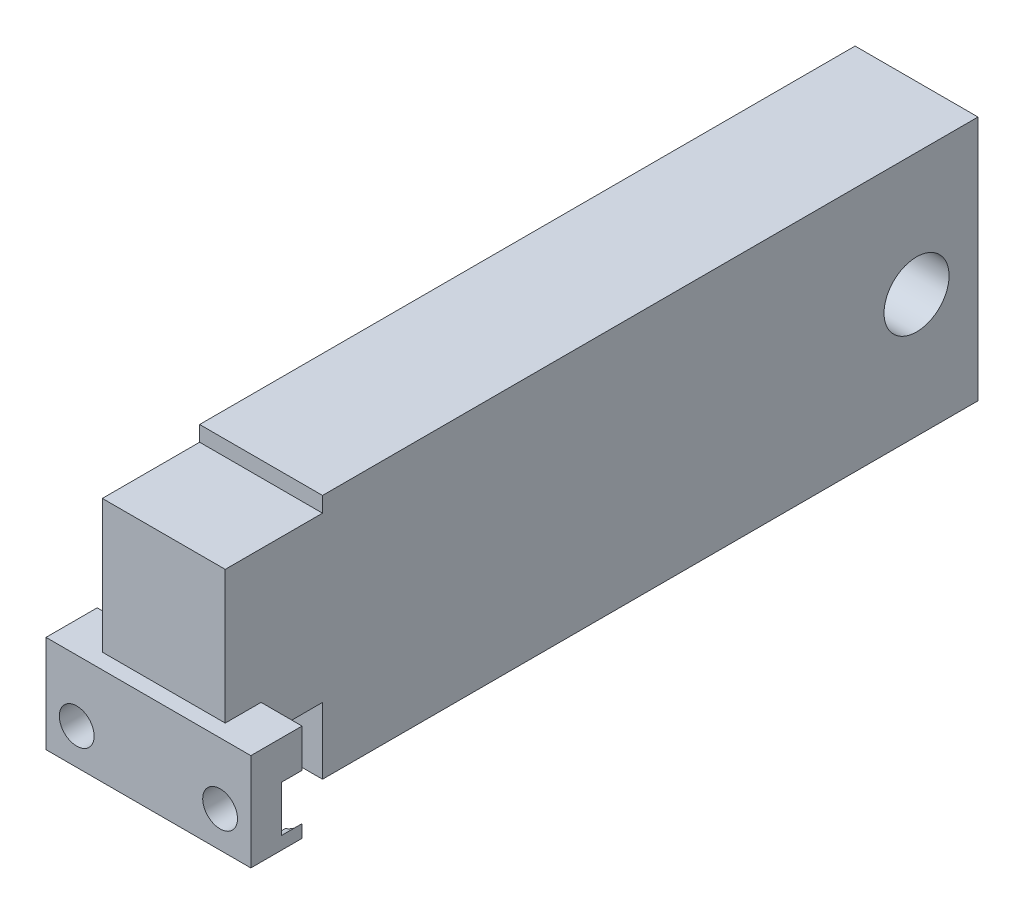
from build123d import *

# Parameters (mm, degrees)
FIVE_MM_ATTACHMENT_FOOT_START                      = -5
SKETCH1_W                                          = 20
SKETCH1_H                                          = 9.5
SKETCH1_R                                          = 1.7
FIVE_MM_ATTACHMENT_FOOT_DEPTH                      = 5
DEEP_ACTUATOR_WEB_START                            = -69
SKETCH2_W                                          = 12
SKETCH2_H                                          = 24
DEEP_ACTUATOR_WEB_DEPTH                            = 67.5
QUARTER20_AXIAL_THREAD_MAJOR_ENVELOPE_DEPTH        = 90.516758208
QUARTER20_AXIAL_THREAD_MAJOR_ENVELOPE_DEPTH_BACK   = 90.516758208
SKETCH3_R                                          = 3.175
BENCH_X_BORE_LOWER_LIGAMENT_START                  = -75
SKETCH4_W                                          = 12
SKETCH4_H                                          = 24
BENCH_X_BORE_LOWER_LIGAMENT_DEPTH                  = 6.01
BENCH_COMPLETE_QUARTER20_MAJOR_ENVELOPE_DEPTH      = 95.21915941
BENCH_COMPLETE_QUARTER20_MAJOR_ENVELOPE_DEPTH_BACK = 95.21915941
SKETCH5_R                                          = 3.175
FIXED_BASE_WINDOW_RELIEF_DEPTH                     = 95.21915941
FIXED_BASE_WINDOW_RELIEF_DEPTH_BACK                = 95.21915941
SKETCH6_W                                          = 6
SKETCH6_H                                          = 7
SKETCH6_W_2                                        = 10
SKETCH6_H_2                                        = 2
XDROP_M3_THROUGH_RECUT_START                       = -5.5
SKETCH7_R                                          = 1.7
XDROP_M3_THROUGH_RECUT_DEPTH                       = 5.5
SKETCH8_R                                          = 3.75
XDROP_M3_BOTTOM_COUNTERBORE_H2_DEPTH               = 2


with BuildPart() as part:
    # Sketch1 → Five_mm_Attachment_Foot (new body)
    with BuildSketch(Plane.XY.offset(FIVE_MM_ATTACHMENT_FOOT_START)):
        with Locations((-20, 29.25)):
            Rectangle(SKETCH1_W, SKETCH1_H)
        with Locations((-27, 28)):
            Circle(SKETCH1_R, mode=Mode.SUBTRACT)
        with Locations((-13, 28)):
            Circle(SKETCH1_R, mode=Mode.SUBTRACT)
    extrude(amount=FIVE_MM_ATTACHMENT_FOOT_DEPTH)

    # Sketch2 → Deep_Actuator_Web (add)
    with BuildSketch(Plane.XY.offset(DEEP_ACTUATOR_WEB_START)):
        with Locations((-20, 36.5)):
            Rectangle(SKETCH2_W, SKETCH2_H)
    extrude(amount=DEEP_ACTUATOR_WEB_DEPTH)

    # Sketch3 → Quarter20_Axial_Thread_Major_Envelope (cut, two sides: drawn at the far end of the back side and taken through both)
    with BuildSketch(Plane(origin=(0, 0, 0), x_dir=(0, 0, -1), z_dir=(1, 0, 0)).offset(-QUARTER20_AXIAL_THREAD_MAJOR_ENVELOPE_DEPTH_BACK)):
        with Locations((69, 36.5)):
            Circle(SKETCH3_R)
    extrude(amount=QUARTER20_AXIAL_THREAD_MAJOR_ENVELOPE_DEPTH + QUARTER20_AXIAL_THREAD_MAJOR_ENVELOPE_DEPTH_BACK, mode=Mode.SUBTRACT)

    # Sketch4 → Bench_X_Bore_Lower_Ligament (add)
    with BuildSketch(Plane.XY.offset(BENCH_X_BORE_LOWER_LIGAMENT_START)):
        with Locations((-20, 36.5)):
            Rectangle(SKETCH4_W, SKETCH4_H)
    extrude(amount=BENCH_X_BORE_LOWER_LIGAMENT_DEPTH)

    # Sketch5 → Bench_Complete_Quarter20_Major_Envelope (cut, two sides: drawn at the far end of the back side and taken through both)
    with BuildSketch(Plane(origin=(0, 0, 0), x_dir=(0, 0, -1), z_dir=(1, 0, 0)).offset(-BENCH_COMPLETE_QUARTER20_MAJOR_ENVELOPE_DEPTH_BACK)):
        with Locations((69, 36.5)):
            Circle(SKETCH5_R)
    extrude(amount=BENCH_COMPLETE_QUARTER20_MAJOR_ENVELOPE_DEPTH + BENCH_COMPLETE_QUARTER20_MAJOR_ENVELOPE_DEPTH_BACK, mode=Mode.SUBTRACT)

    # Sketch6 → Fixed_Base_Window_Relief (cut, two sides: drawn at the far end of the back side and taken through both)
    with BuildSketch(Plane(origin=(0, 0, 0), x_dir=(0, 0, -1), z_dir=(1, 0, 0)).offset(-FIXED_BASE_WINDOW_RELIEF_DEPTH_BACK)):
        with Locations((8, 27.5)):
            Rectangle(SKETCH6_W, SKETCH6_H)
        with Locations((6, 48)):
            Rectangle(SKETCH6_W_2, SKETCH6_H_2)
    extrude(amount=FIXED_BASE_WINDOW_RELIEF_DEPTH + FIXED_BASE_WINDOW_RELIEF_DEPTH_BACK, mode=Mode.SUBTRACT)

    # Sketch7 → XDrop_M3_Through_Recut (cut)
    with BuildSketch(Plane.XY.offset(XDROP_M3_THROUGH_RECUT_START)):
        with Locations((-27, 28)):
            Circle(SKETCH7_R)
        with Locations((-13, 28)):
            Circle(SKETCH7_R)
    extrude(amount=XDROP_M3_THROUGH_RECUT_DEPTH, mode=Mode.SUBTRACT)

    # Sketch8 → XDrop_M3_Bottom_Counterbore_H2 (cut)
    with BuildSketch(Plane(origin=(0, 0, -5), x_dir=(-1, 0, 0), z_dir=(0, 0, -1))):
        with Locations((27, 28)):
            Circle(SKETCH8_R)
        with Locations((13, 28)):
            Circle(SKETCH8_R)
    extrude(amount=-XDROP_M3_BOTTOM_COUNTERBORE_H2_DEPTH, mode=Mode.SUBTRACT)


solid = part.part
